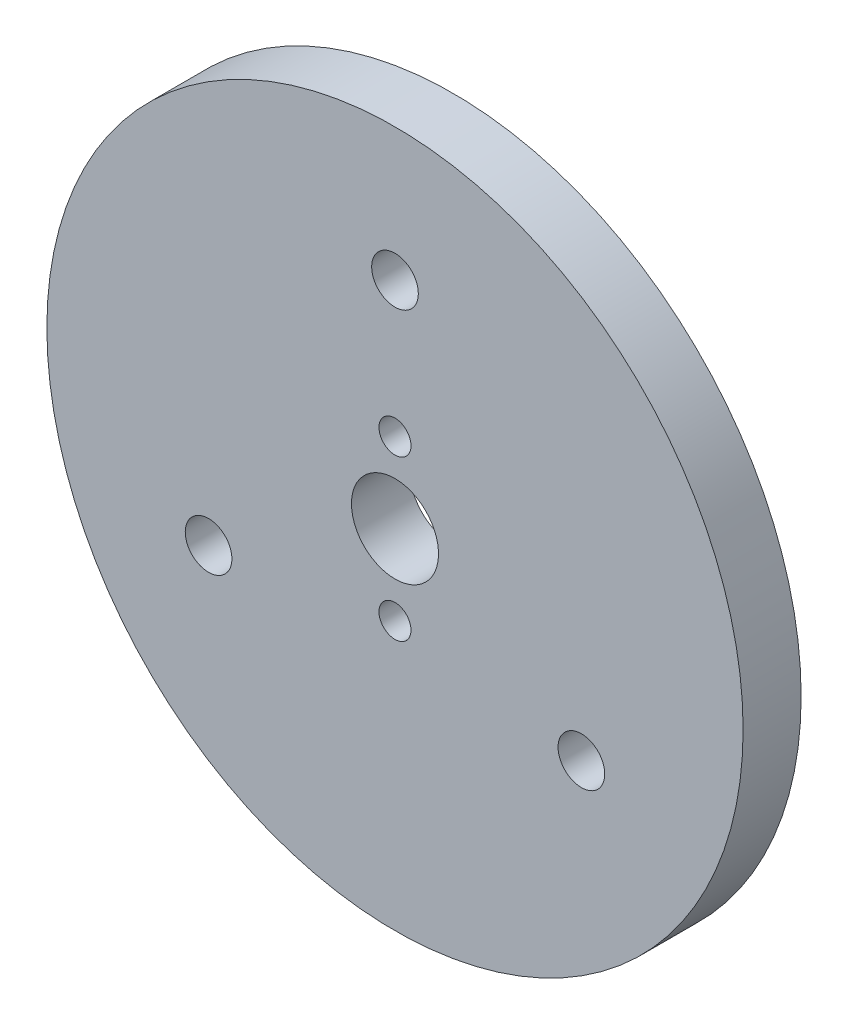
from build123d import *

# Parameters (mm, degrees)
SKETCH1_R                  = 38.1
BOSS_EXTRUDE1_DEPTH        = 6.35
SKETCH2_R                  = 1.35255
CUT_EXTRUDE1_DEPTH         = 55.254423783
SKETCH3_R                  = 4.7625
CUT_EXTRUDE2_DEPTH         = 6.35
CIRPATTERN2_COUNT          = 3
SKETCH5_R                  = 1.7526
CUT_EXTRUDE4_DEPTH         = 6.35
CIRPATTERN3_COUNT          = 2
F_10_CLEARANCE_HOLE1_D     = 5.1054
F_10_CLEARANCE_HOLE1_DEPTH = 11.43
F_10_CLEARANCE_HOLE1_TIP   = 1.533816902


with BuildPart() as part:
    # Sketch1 → Boss-Extrude1 (new body)
    with BuildSketch(Plane.XY):
        Circle(SKETCH1_R)
    extrude(amount=BOSS_EXTRUDE1_DEPTH)

    # Sketch2 → Cut-Extrude1 (cut, through all)
    with BuildSketch(Plane.XY.offset(6.35)):
        with Locations((0, 23.5585)):
            Circle(SKETCH2_R)
    cut_extrude1 = extrude(amount=-CUT_EXTRUDE1_DEPTH, mode=Mode.SUBTRACT)

    # Sketch3 → Cut-Extrude2 (cut)
    with BuildSketch(Plane(origin=(0, 0, 0), x_dir=(-1, 0, 0), z_dir=(0, 0, -1))):
        Circle(SKETCH3_R)
    extrude(amount=-CUT_EXTRUDE2_DEPTH, mode=Mode.SUBTRACT)

    # CirPattern2: Cut-Extrude1 ×3 about axis
    cirpattern2_axis = Axis((0, 0, -0.3175), (0, 0, 1))
    for i in range(1, CIRPATTERN2_COUNT):
        add(cut_extrude1.rotate(cirpattern2_axis, i * 360 / CIRPATTERN2_COUNT), mode=Mode.SUBTRACT)

    # Sketch5 → Cut-Extrude4 (cut)
    with BuildSketch(Plane(origin=(0, 0, 0), x_dir=(-1, 0, 0), z_dir=(0, 0, -1))):
        with Locations((0, 8.7376)):
            Circle(SKETCH5_R)
    cut_extrude4 = extrude(amount=-CUT_EXTRUDE4_DEPTH, mode=Mode.SUBTRACT)

    # CirPattern3: Cut-Extrude4 ×2 about axis
    cirpattern3_axis = Axis((0, 0, -0.3175), (0, 0, 1))
    for i in range(1, CIRPATTERN3_COUNT):
        add(cut_extrude4.rotate(cirpattern3_axis, i * 360 / CIRPATTERN3_COUNT), mode=Mode.SUBTRACT)

    # #10 Clearance Hole1
    with Locations(Plane(origin=(0, 0, 0), x_dir=(-1, 0, 0), z_dir=(0, 0, -1))):
        with Locations((0, 23.5585), (-20.402259475, -11.77925), (20.402259475, -11.77925)):
            Hole(F_10_CLEARANCE_HOLE1_D / 2, depth=F_10_CLEARANCE_HOLE1_DEPTH)
            with Locations((0, 0, -(F_10_CLEARANCE_HOLE1_DEPTH + F_10_CLEARANCE_HOLE1_TIP / 2))):  # 118° drill point
                Cone(0, F_10_CLEARANCE_HOLE1_D / 2, F_10_CLEARANCE_HOLE1_TIP, mode=Mode.SUBTRACT)


solid = part.part
